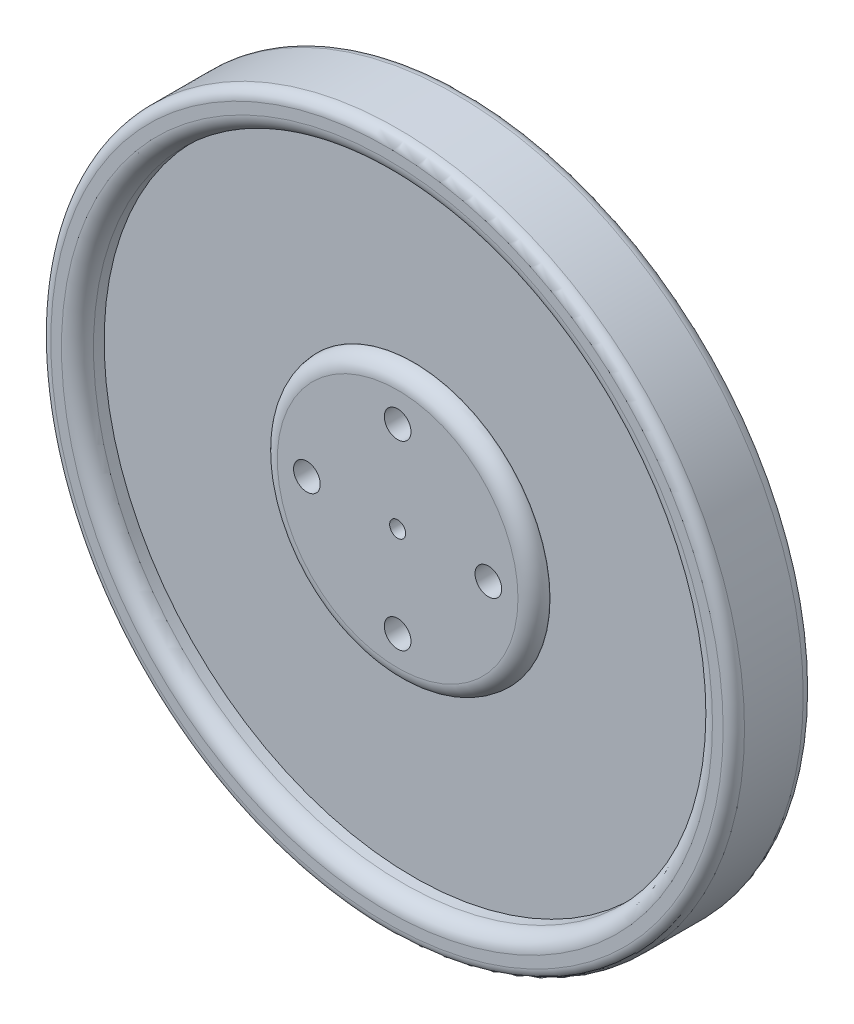
from build123d import *

# Parameters (mm, degrees)
ESQUISSE1_R              = 32.5
BOSS_EXTRU_1_DEPTH       = 12
ESQUISSE2_R              = 65
ENL_V_MAT_EXTRU_1_DEPTH  = 3
ESQUISSE5_R              = 29
ENL_V_MAT_EXTRU_4_DEPTH  = 3
ESQUISSE6_R              = 1
ENL_V_MAT_EXTRU_6_DEPTH  = 32
ENL_V_MAT_EXTRU_7_DEPTH  = 32
ESQUISSE9_R              = 1.43
ENL_V_MAT_EXTRU_8_DEPTH  = 32
ESQUISSE11_R             = 2.429998502
ENL_V_MAT_EXTRU_9_DEPTH  = 3
CONG_7_R                 = 1
ESQUISSE14_R             = 29
ENL_V_MAT_EXTRU_10_DEPTH = 1
ESQUISSE16_R             = 39.398692539
ENL_V_MAT_EXTRU_12_DEPTH = 1.5
CONG_10_R                = 1.5
CONG_11_R                = 1
CONG_12_R                = 1
ENL_V_MAT_EXTRU_13_DEPTH = 10
ESQUISSE19_R             = 3.300449349
BOSS_EXTRU_2_DEPTH       = 5
ESQUISSE20_R             = 12.25
ENL_V_MAT_EXTRU_14_DEPTH = 3
ESQUISSE21_R             = 12.75
BOSS_EXTRU_3_DEPTH       = 1.5
D_POUILLE1_ANGLE         = 1
CONG_13_R                = 1.5
ESQUISSE22_R             = 1.25
ENL_V_MAT_EXTRU_15_DEPTH = 1.5
ESQUISSE23_R             = 0.75
ENL_V_MAT_EXTRU_16_DEPTH = 12.5


with BuildPart() as part:
    # Esquisse1 → Boss.-Extru.1 (new body)
    with BuildSketch(Plane.XY):
        Circle(ESQUISSE1_R)
    extrude(amount=BOSS_EXTRU_1_DEPTH)

    # Esquisse2 → Enlèv. mat.-Extru.1 (cut)
    with BuildSketch(Plane.XY.offset(12)):
        Circle(ESQUISSE2_R)
    extrude(amount=-ENL_V_MAT_EXTRU_1_DEPTH, mode=Mode.SUBTRACT)

    # Esquisse5 → Enlèv. mat.-Extru.4 (cut)
    with BuildSketch(Plane.XY.offset(9)):
        Circle(ESQUISSE5_R)
    extrude(amount=-ENL_V_MAT_EXTRU_4_DEPTH, mode=Mode.SUBTRACT)

    # Esquisse6 → Enlèv. mat.-Extru.6 (cut)
    with BuildSketch(Plane.XY.offset(6)):
        Circle(ESQUISSE6_R)
    extrude(amount=-ENL_V_MAT_EXTRU_6_DEPTH, mode=Mode.SUBTRACT)

    # Esquisse8 → Enlèv. mat.-Extru.7 (cut)
    with BuildSketch(Plane.XY.offset(6)):
        with BuildLine():
            Line((0.686378878, -0.603797194), (0.218015206, -0.444113134))
            Line((0.218015206, -0.444113134), (0.058394068, -0.912292249))
            Line((0.058394068, -0.912292249), (0.603363618, -2.021101765))
            ThreePointArc((0.603363618, -2.021101765), (1.078670728, -2.177389088), (1.224556135, -1.698786931))
            Line((1.224556135, -1.698786931), (0.686378878, -0.603797194))
        make_face()
        with BuildLine():
            Line((0.058394068, -0.912292249), (-0.159875378, -0.468195439))
            Line((-0.159875378, -0.468195439), (-0.603797194, -0.686378878))
            Line((-0.603797194, -0.686378878), (-1.002492257, -1.855777269))
            ThreePointArc((-1.002492257, -1.855777269), (-0.776911203, -2.302381976), (-0.335331812, -2.067115706))
            Line((-0.335331812, -2.067115706), (0.058394068, -0.912292249))
        make_face()
        with BuildLine():
            Line((-0.603797194, -0.686378878), (-0.444113134, -0.218015206))
            Line((-0.444113134, -0.218015206), (-0.912292249, -0.058394068))
            Line((-0.912292249, -0.058394068), (-2.021101765, -0.603363618))
            ThreePointArc((-2.021101765, -0.603363618), (-2.177389088, -1.078670728), (-1.698786931, -1.224556135))
            Line((-1.698786931, -1.224556135), (-0.603797194, -0.686378878))
        make_face()
        with BuildLine():
            Line((-0.912292249, -0.058394068), (-0.468195439, 0.159875378))
            Line((-0.468195439, 0.159875378), (-0.686378878, 0.603797194))
            Line((-0.686378878, 0.603797194), (-1.855777269, 1.002492257))
            ThreePointArc((-1.855777269, 1.002492257), (-2.302381976, 0.776911203), (-2.067115706, 0.335331812))
            Line((-2.067115706, 0.335331812), (-0.912292249, -0.058394068))
        make_face()
        with BuildLine():
            Line((-0.686378878, 0.603797194), (-0.218015206, 0.444113134))
            Line((-0.218015206, 0.444113134), (-0.058394068, 0.912292249))
            Line((-0.058394068, 0.912292249), (-0.603363618, 2.021101765))
            ThreePointArc((-0.603363618, 2.021101765), (-1.078670728, 2.177389088), (-1.224556135, 1.698786931))
            Line((-1.224556135, 1.698786931), (-0.686378878, 0.603797194))
        make_face()
        with BuildLine():
            Line((-0.058394068, 0.912292249), (0.159875378, 0.468195439))
            Line((0.159875378, 0.468195439), (0.603797194, 0.686378878))
            Line((0.603797194, 0.686378878), (1.002492257, 1.855777269))
            ThreePointArc((1.002492257, 1.855777269), (0.776911203, 2.302381976), (0.335331812, 2.067115706))
            Line((0.335331812, 2.067115706), (-0.058394068, 0.912292249))
        make_face()
        with BuildLine():
            Line((0.603797194, 0.686378878), (0.444113134, 0.218015206))
            Line((0.444113134, 0.218015206), (0.912292249, 0.058394068))
            Line((0.912292249, 0.058394068), (2.021101765, 0.603363618))
            ThreePointArc((2.021101765, 0.603363618), (2.177389088, 1.078670728), (1.698786931, 1.224556135))
            Line((1.698786931, 1.224556135), (0.603797194, 0.686378878))
        make_face()
        with BuildLine():
            Line((0.912292249, 0.058394068), (0.468195439, -0.159875378))
            Line((0.468195439, -0.159875378), (0.686378878, -0.603797194))
            Line((0.686378878, -0.603797194), (1.855777269, -1.002492257))
            ThreePointArc((1.855777269, -1.002492257), (2.302381976, -0.776911203), (2.067115706, -0.335331812))
            Line((2.067115706, -0.335331812), (0.912292249, 0.058394068))
        make_face()
    extrude(amount=-ENL_V_MAT_EXTRU_7_DEPTH, mode=Mode.SUBTRACT)

    # Esquisse9 → Enlèv. mat.-Extru.8 (cut)
    with BuildSketch(Plane(origin=(0, 0, 0), x_dir=(-1, 0, 0), z_dir=(0, 0, -1))):
        Circle(ESQUISSE9_R)
    extrude(amount=-ENL_V_MAT_EXTRU_8_DEPTH, mode=Mode.SUBTRACT)

    # Esquisse11 → Enlèv. mat.-Extru.9 (cut)
    with BuildSketch(Plane.XY.offset(6)):
        Circle(ESQUISSE11_R)
    extrude(amount=-ENL_V_MAT_EXTRU_9_DEPTH, mode=Mode.SUBTRACT)

    # Congé7
    cong_7_edges = [part.edges().sort_by_distance(p)[0] for p in [
        (2.425005219, 0.155699747, 6),
    ]]
    fillet(cong_7_edges, radius=CONG_7_R)

    # Esquisse14 → Enlèv. mat.-Extru.10 (cut)
    with BuildSketch(Plane.XY.offset(6)):
        Circle(ESQUISSE14_R)
    extrude(amount=-ENL_V_MAT_EXTRU_10_DEPTH, mode=Mode.SUBTRACT)

    # Esquisse16 → Enlèv. mat.-Extru.12 (cut)
    with BuildSketch(Plane.XY.offset(9)):
        Circle(ESQUISSE16_R)
    extrude(amount=-ENL_V_MAT_EXTRU_12_DEPTH, mode=Mode.SUBTRACT)

    # Congé10
    cong_10_edges = [part.edges().sort_by_distance(p)[0] for p in [
        (-29, 0, 7.5),
    ]]
    fillet(cong_10_edges, radius=CONG_10_R)

    # Congé11
    cong_11_edges = [part.edges().sort_by_distance(p)[0] for p in [
        (-32.5, 0, 7.5),
    ]]
    fillet(cong_11_edges, radius=CONG_11_R)

    # Congé12
    cong_12_edges = [part.edges().sort_by_distance(p)[0] for p in [
        (-32.5, 0, 0),
    ]]
    fillet(cong_12_edges, radius=CONG_12_R)

    # Esquisse18 → Enlèv. mat.-Extru.13 (cut)
    with BuildSketch(Plane(origin=(0, 0, 0), x_dir=(-1, 0, 0), z_dir=(0, 0, -1))):
        with BuildLine():
            ThreePointArc((-1.246616311, 8.408088235), (-0.850767387, 7.584197154), (0, 7.25))
            Line((0, 7.25), (0, 8.5))
            ThreePointArc((0, 8.5), (-0.625, 8.476990917), (-1.246616311, 8.408088235))
        make_face()
        with BuildLine():
            Line((0, 8.5), (0, 7.25))
            ThreePointArc((0, 7.25), (0.850767387, 7.584197154), (1.246616311, 8.408088235))
            ThreePointArc((1.246616311, 8.408088235), (0.625, 8.476990917), (0, 8.5))
        make_face()
        with BuildLine():
            ThreePointArc((-1.246616311, 8.408088235), (-0.625, 8.476990917), (0, 8.5))
            Line((0, 8.5), (0, 9.75))
            ThreePointArc((0, 9.75), (-0.915802846, 9.350767387), (-1.246616311, 8.408088235))
        make_face()
        with BuildLine():
            Line((0, 9.75), (0, 8.5))
            ThreePointArc((0, 8.5), (0.625, 8.476990917), (1.246616311, 8.408088235))
            ThreePointArc((1.246616311, 8.408088235), (1.249153791, 8.454012986), (1.25, 8.5))
            ThreePointArc((1.25, 8.5), (0.883883476, 9.383883476), (0, 9.75))
        make_face()
        with BuildLine():
            ThreePointArc((-8.408088235, -1.246616311), (-7.584197154, -0.850767387), (-7.25, 0))
            Line((-7.25, 0), (-8.5, 0))
            ThreePointArc((-8.5, 0), (-8.476990917, -0.625), (-8.408088235, -1.246616311))
        make_face()
        with BuildLine():
            Line((-8.5, 0), (-7.25, 0))
            ThreePointArc((-7.25, 0), (-7.584197154, 0.850767387), (-8.408088235, 1.246616311))
            ThreePointArc((-8.408088235, 1.246616311), (-8.476990917, 0.625), (-8.5, 0))
        make_face()
        with BuildLine():
            ThreePointArc((-8.408088235, -1.246616311), (-8.476990917, -0.625), (-8.5, 0))
            Line((-8.5, 0), (-9.75, 0))
            ThreePointArc((-9.75, 0), (-9.350767387, -0.915802846), (-8.408088235, -1.246616311))
        make_face()
        with BuildLine():
            Line((-9.75, 0), (-8.5, 0))
            ThreePointArc((-8.5, 0), (-8.476990917, 0.625), (-8.408088235, 1.246616311))
            ThreePointArc((-8.408088235, 1.246616311), (-9.350767387, 0.915802846), (-9.75, 0))
        make_face()
        with BuildLine():
            ThreePointArc((8.408088235, 1.246616311), (7.584197154, 0.850767387), (7.25, 0))
            Line((7.25, 0), (8.5, 0))
            ThreePointArc((8.5, 0), (8.476990917, 0.625), (8.408088235, 1.246616311))
        make_face()
        with BuildLine():
            Line((8.5, 0), (7.25, 0))
            ThreePointArc((7.25, 0), (7.584197154, -0.850767387), (8.408088235, -1.246616311))
            ThreePointArc((8.408088235, -1.246616311), (8.476990917, -0.625), (8.5, 0))
        make_face()
        with BuildLine():
            ThreePointArc((8.408088235, 1.246616311), (8.476990917, 0.625), (8.5, 0))
            Line((8.5, 0), (9.75, 0))
            ThreePointArc((9.75, 0), (9.350767387, 0.915802846), (8.408088235, 1.246616311))
        make_face()
        with BuildLine():
            Line((9.75, 0), (8.5, 0))
            ThreePointArc((8.5, 0), (8.476990917, -0.625), (8.408088235, -1.246616311))
            ThreePointArc((8.408088235, -1.246616311), (9.350767387, -0.915802846), (9.75, 0))
        make_face()
        with BuildLine():
            ThreePointArc((1.246616311, -8.408088235), (0.850767387, -7.584197154), (0, -7.25))
            Line((0, -7.25), (0, -8.5))
            ThreePointArc((0, -8.5), (0.625, -8.476990917), (1.246616311, -8.408088235))
        make_face()
        with BuildLine():
            Line((0, -8.5), (0, -7.25))
            ThreePointArc((0, -7.25), (-0.850767387, -7.584197154), (-1.246616311, -8.408088235))
            ThreePointArc((-1.246616311, -8.408088235), (-0.625, -8.476990917), (0, -8.5))
        make_face()
        with BuildLine():
            ThreePointArc((1.246616311, -8.408088235), (0.625, -8.476990917), (0, -8.5))
            Line((0, -8.5), (0, -9.75))
            ThreePointArc((0, -9.75), (0.883883476, -9.383883476), (1.25, -8.5))
            ThreePointArc((1.25, -8.5), (1.249153791, -8.454012986), (1.246616311, -8.408088235))
        make_face()
        with BuildLine():
            Line((0, -9.75), (0, -8.5))
            ThreePointArc((0, -8.5), (-0.625, -8.476990917), (-1.246616311, -8.408088235))
            ThreePointArc((-1.246616311, -8.408088235), (-0.915802846, -9.350767387), (0, -9.75))
        make_face()
    extrude(amount=-ENL_V_MAT_EXTRU_13_DEPTH, mode=Mode.SUBTRACT)

    # Esquisse19 → Boss.-Extru.2 (add)
    with BuildSketch(Plane(origin=(0, 0, 0), x_dir=(-1, 0, 0), z_dir=(0, 0, -1))):
        Circle(ESQUISSE19_R)
    extrude(amount=-BOSS_EXTRU_2_DEPTH)

    # Esquisse20 → Enlèv. mat.-Extru.14 (cut)
    with BuildSketch(Plane(origin=(0, 0, 0), x_dir=(-1, 0, 0), z_dir=(0, 0, -1))):
        Circle(ESQUISSE20_R)
    extrude(amount=-ENL_V_MAT_EXTRU_14_DEPTH, mode=Mode.SUBTRACT)

    # Esquisse21 → Boss.-Extru.3 (add)
    with BuildSketch(Plane.XY.offset(5)):
        Circle(ESQUISSE21_R)
    extrude(amount=BOSS_EXTRU_3_DEPTH)

    # Dépouille1
    d_pouille1_faces = [part.faces().sort_by_distance(p)[0] for p in [
        (-12.75, 0, 5.75),
    ]]
    draft(d_pouille1_faces, Plane.XY.offset(6.5), D_POUILLE1_ANGLE)

    # Congé13
    cong_13_edges = [part.edges().sort_by_distance(p)[0] for p in [
        (-12.75, 0, 6.5),
    ]]
    fillet(cong_13_edges, radius=CONG_13_R)

    # Esquisse22 → Enlèv. mat.-Extru.15 (cut)
    with BuildSketch(Plane(origin=(0, 0, 5), x_dir=(-1, 0, 0), z_dir=(0, 0, -1))):
        with Locations((0, 8.5)):
            Circle(ESQUISSE22_R)
        with Locations((-8.5, 0)):
            Circle(ESQUISSE22_R)
        with Locations((8.5, 0)):
            Circle(ESQUISSE22_R)
        with Locations((0, -8.5)):
            Circle(ESQUISSE22_R)
    extrude(amount=-ENL_V_MAT_EXTRU_15_DEPTH, mode=Mode.SUBTRACT)

    # Esquisse23 → Enlèv. mat.-Extru.16 (cut)
    with BuildSketch(Plane(origin=(0, 0, 3), x_dir=(-1, 0, 0), z_dir=(0, 0, -1))):
        Circle(ESQUISSE23_R)
    extrude(amount=-ENL_V_MAT_EXTRU_16_DEPTH, mode=Mode.SUBTRACT)


solid = part.part
